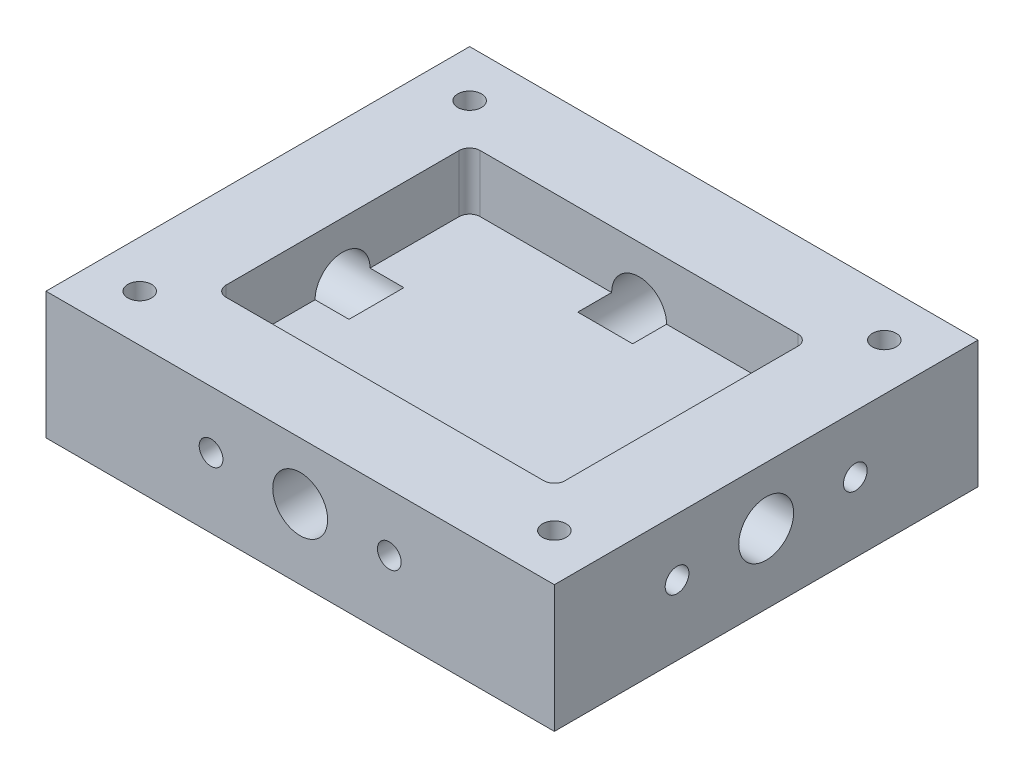
from build123d import *

# Parameters (mm, degrees)
SKETCH1_W               = 38.1
SKETCH1_H               = 31.75
BOSS_EXTRUDE1_DEPTH     = 9.525
CUT_EXTRUDE2_DEPTH      = 4.2926
SKETCH3_R               = 2.0574
CUT_EXTRUDE3_DEPTH      = 8.89
SKETCH7_R               = 2.0574
CUT_EXTRUDE5_DEPTH      = 8.89
SKETCH8_R               = 0.889
CUT_EXTRUDE6_DEPTH      = 4.7625
MIRROR4_COPY_1_SKETCH_R = 0.889
MIRROR4_COPY_1_DEPTH    = 4.7625
SKETCH11_R              = 0.889
CUT_EXTRUDE7_DEPTH      = 4.7625
MIRROR6_COPY_1_SKETCH_R = 0.889
MIRROR6_COPY_1_DEPTH    = 4.7625
SKETCH12_R              = 0.889
CUT_EXTRUDE9_DEPTH      = 7.9375


with BuildPart() as part:
    # Sketch1 → Boss-Extrude1 (new body)
    with BuildSketch(Plane(origin=(0, 0, 0), x_dir=(1, 0, 0), z_dir=(0, 1, 0))):
        Rectangle(SKETCH1_W, SKETCH1_H)
    extrude(amount=BOSS_EXTRUDE1_DEPTH)

    # Sketch2 → Cut-Extrude2 (cut)
    with BuildSketch(Plane(origin=(0, 9.525, 0), x_dir=(1, 0, 0), z_dir=(0, 1, 0))):
        with BuildLine():
            Line((-11.90625, -9.525), (11.90625, -9.525))
            ThreePointArc((11.90625, -9.525), (12.467516008, -9.292516008), (12.7, -8.73125))
            Line((12.7, -8.73125), (12.7, 8.73125))
            ThreePointArc((12.7, 8.73125), (12.467516008, 9.292516008), (11.90625, 9.525))
            Line((11.90625, 9.525), (-11.90625, 9.525))
            ThreePointArc((-11.90625, 9.525), (-12.467516008, 9.292516008), (-12.7, 8.73125))
            Line((-12.7, 8.73125), (-12.7, -8.73125))
            ThreePointArc((-12.7, -8.73125), (-12.467516008, -9.292516008), (-11.90625, -9.525))
        make_face()
    extrude(amount=-CUT_EXTRUDE2_DEPTH, mode=Mode.SUBTRACT)

    # Sketch3 → Cut-Extrude3 (cut)
    with BuildSketch(Plane.ZY.offset(19.05)):
        with Locations((0, 5.2324)):
            Circle(SKETCH3_R)
    cut_extrude3 = extrude(amount=-CUT_EXTRUDE3_DEPTH, mode=Mode.SUBTRACT)

    # Mirror1: Cut-Extrude3 across plane
    add(cut_extrude3.mirror(Plane(origin=(0, 0, 0), x_dir=(0, 0, 1), z_dir=(1, 0, 0))), mode=Mode.SUBTRACT)

    # Sketch7 → Cut-Extrude5 (cut)
    with BuildSketch(Plane(origin=(0, 0, -15.875), x_dir=(-1, 0, 0), z_dir=(0, 0, -1))):
        with Locations((0, 5.2324)):
            Circle(SKETCH7_R)
    cut_extrude5 = extrude(amount=-CUT_EXTRUDE5_DEPTH, mode=Mode.SUBTRACT)

    # Mirror2: Cut-Extrude5 across plane
    add(cut_extrude5.mirror(Plane.XY), mode=Mode.SUBTRACT)

    # Sketch8 → Cut-Extrude6 (cut)
    with BuildSketch(Plane(origin=(19.05, 0, 0), x_dir=(0, 0, -1), z_dir=(1, 0, 0))):
        with Locations((6.6802, 5.2324)):
            Circle(SKETCH8_R)
    cut_extrude6 = extrude(amount=-CUT_EXTRUDE6_DEPTH, mode=Mode.SUBTRACT)

    # Mirror3: Cut-Extrude6 across plane
    add(cut_extrude6.mirror(Plane.XY), mode=Mode.SUBTRACT)

    # Mirror4: Cut-Extrude6 across plane
    add(cut_extrude6.mirror(Plane(origin=(0, 0, 0), x_dir=(0, 0, 1), z_dir=(1, 0, 0))), mode=Mode.SUBTRACT)

    # Mirror4 copy 1 sketch → Mirror4 copy 1 (cut)
    with BuildSketch(Plane.ZY.offset(19.05)):
        with Locations((6.6802, 5.2324)):
            Circle(MIRROR4_COPY_1_SKETCH_R)
    extrude(amount=-MIRROR4_COPY_1_DEPTH, mode=Mode.SUBTRACT)

    # Sketch11 → Cut-Extrude7 (cut)
    with BuildSketch(Plane.XY.offset(15.875)):
        with Locations((6.6802, 5.2324)):
            Circle(SKETCH11_R)
    cut_extrude7 = extrude(amount=-CUT_EXTRUDE7_DEPTH, mode=Mode.SUBTRACT)

    # Mirror5: Cut-Extrude7 across plane
    add(cut_extrude7.mirror(Plane(origin=(0, 0, 0), x_dir=(0, 0, 1), z_dir=(1, 0, 0))), mode=Mode.SUBTRACT)

    # Mirror6: Cut-Extrude7 across plane
    add(cut_extrude7.mirror(Plane.XY), mode=Mode.SUBTRACT)

    # Mirror6 copy 1 sketch → Mirror6 copy 1 (cut)
    with BuildSketch(Plane(origin=(0, 0, -15.875), x_dir=(-1, 0, 0), z_dir=(0, 0, -1))):
        with Locations((6.6802, 5.2324)):
            Circle(MIRROR6_COPY_1_SKETCH_R)
    extrude(amount=-MIRROR6_COPY_1_DEPTH, mode=Mode.SUBTRACT)

    # Sketch12 → Cut-Extrude9 (cut)
    with BuildSketch(Plane(origin=(0, 9.525, 0), x_dir=(1, 0, 0), z_dir=(0, 1, 0))):
        with Locations(Location((-15.53845, 12.36345, 0), (0, 0, 270))):
            Circle(SKETCH12_R)
        with Locations(Location((15.53845, 12.36345, 0), (0, 0, 270))):
            Circle(SKETCH12_R)
        with Locations(Location((-15.53845, -12.36345, 0), (0, 0, 270))):
            Circle(SKETCH12_R)
        with Locations(Location((15.53845, -12.36345, 0), (0, 0, 270))):
            Circle(SKETCH12_R)
    extrude(amount=-CUT_EXTRUDE9_DEPTH, mode=Mode.SUBTRACT)


solid = part.part
